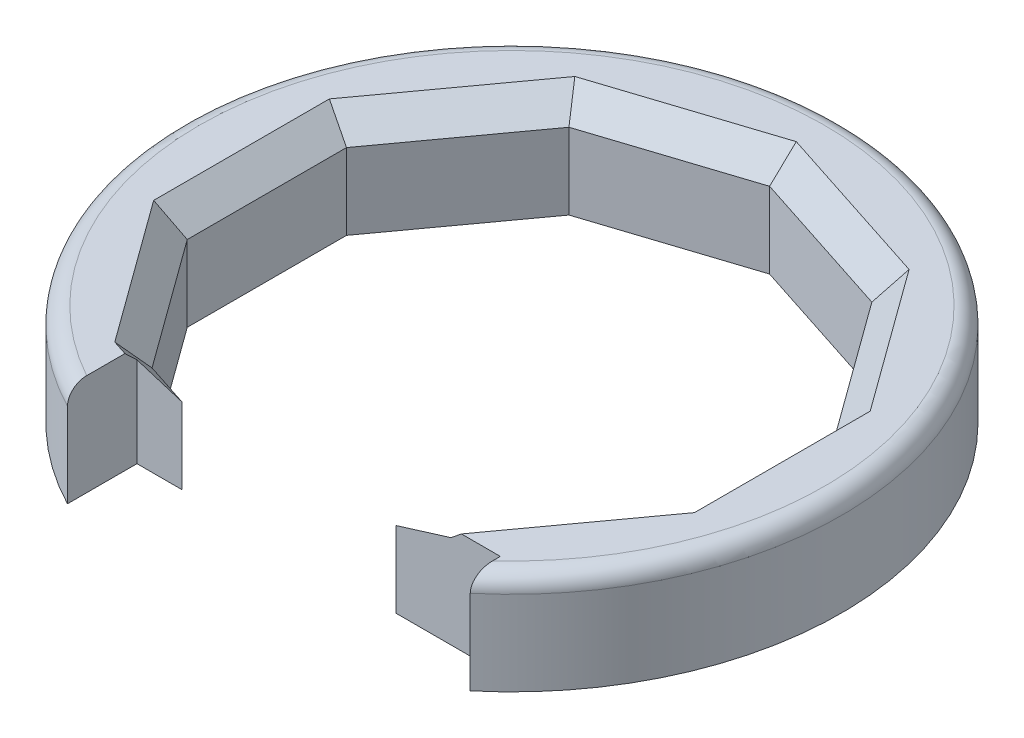
from build123d import *

# Parameters (mm, degrees)
SKETCH1_R           = 39
BOSS_EXTRUDE1_DEPTH = 12
FILLET1_R           = 2
CHAMFER1_SIZE       = 3
SKETCH2_W           = 43
SKETCH2_H           = 43
CUT_EXTRUDE2_DEPTH  = 57.444663167


with BuildPart() as part:
    # Sketch1 → Boss-Extrude1 (new body)
    with BuildSketch(Plane(origin=(0, 0, 0), x_dir=(1, 0, 0), z_dir=(0, 1, 0))):
        with Locations(Location((0, 0, 0), (0, 0, 270))):
            Circle(SKETCH1_R)
        Polygon((17.922985674, 24.668873442), (0, 30.492404503), (-17.922985674, 24.668873442), (-29, 9.422671191), (-29, -9.422671191), (-17.922985674, -24.668873442), (0, -30.492404503), (17.922985674, -24.668873442), (29, -9.422671191), (29, 9.422671191), align=None, mode=Mode.SUBTRACT)
    extrude(amount=BOSS_EXTRUDE1_DEPTH)

    # Fillet1
    fillet1_edges = [part.edges().sort_by_distance(p)[0] for p in [
        (0, 12, -39),
    ]]
    fillet(fillet1_edges, radius=FILLET1_R)

    # Chamfer1
    chamfer1_edges = [part.edges().sort_by_distance(p)[0] for p in [
        (23.461492837, 12, -17.045772316),
        (8.961492837, 12, -27.580638973),
        (-8.961492837, 12, -27.580638973),
        (-23.461492837, 12, -17.045772316),
        (-29, 12, 0),
        (-23.461492837, 12, 17.045772316),
        (-8.961492837, 12, 27.580638973),
        (8.961492837, 12, 27.580638973),
        (23.461492837, 12, 17.045772316),
        (29, 12, 0),
    ]]
    chamfer(chamfer1_edges, length=CHAMFER1_SIZE)

    # Sketch2 → Cut-Extrude2 (cut, through all)
    with BuildSketch(Plane(origin=(0, 0, 0), x_dir=(1, 0, 0), z_dir=(0, 1, 0))):
        with Locations((3.5, -47.872225768)):
            Rectangle(SKETCH2_W, SKETCH2_H)
    extrude(amount=CUT_EXTRUDE2_DEPTH, mode=Mode.SUBTRACT)


solid = part.part
